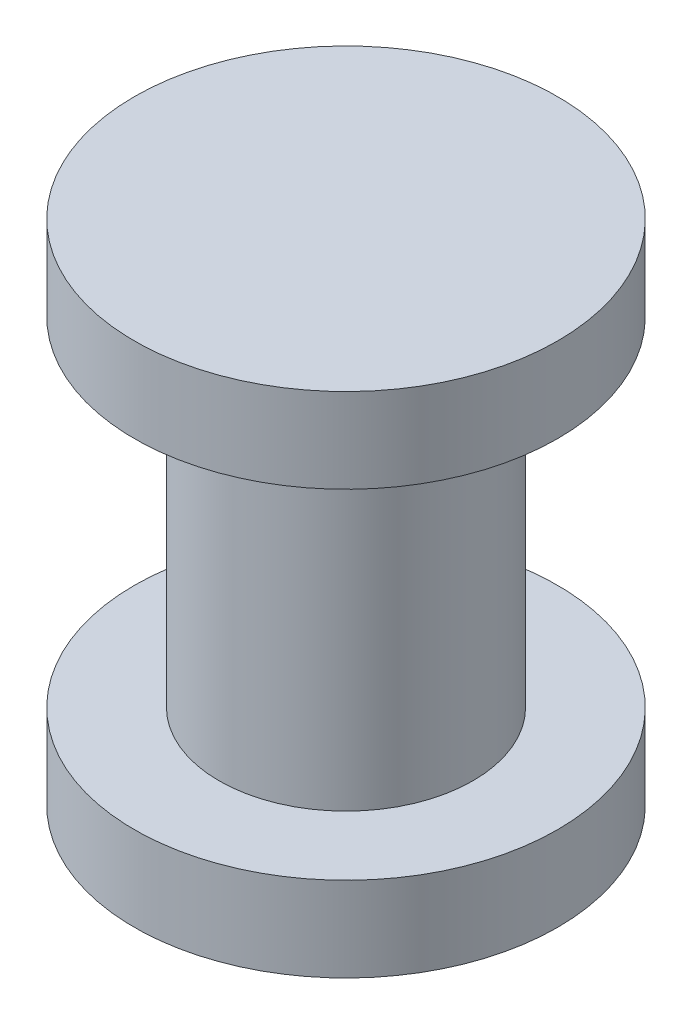
from build123d import *


with BuildPart() as part:
    # Sketch1 → Revolve1 (revolve)
    with BuildSketch(Plane.XY):
        Polygon((-14.761543591, 25.948638362), (-17.261543591, 25.948638362), (-17.261543591, 24.948638362), (-16.261543591, 24.948638362), (-16.261543591, 20.948638362), (-17.261543591, 20.948638362), (-17.261543591, 19.948638362), (-14.761543591, 19.948638362), align=None)
    revolve(axis=Axis((-14.761543591, 25.948638362, 0), (0, -1, 0)))


solid = part.part
